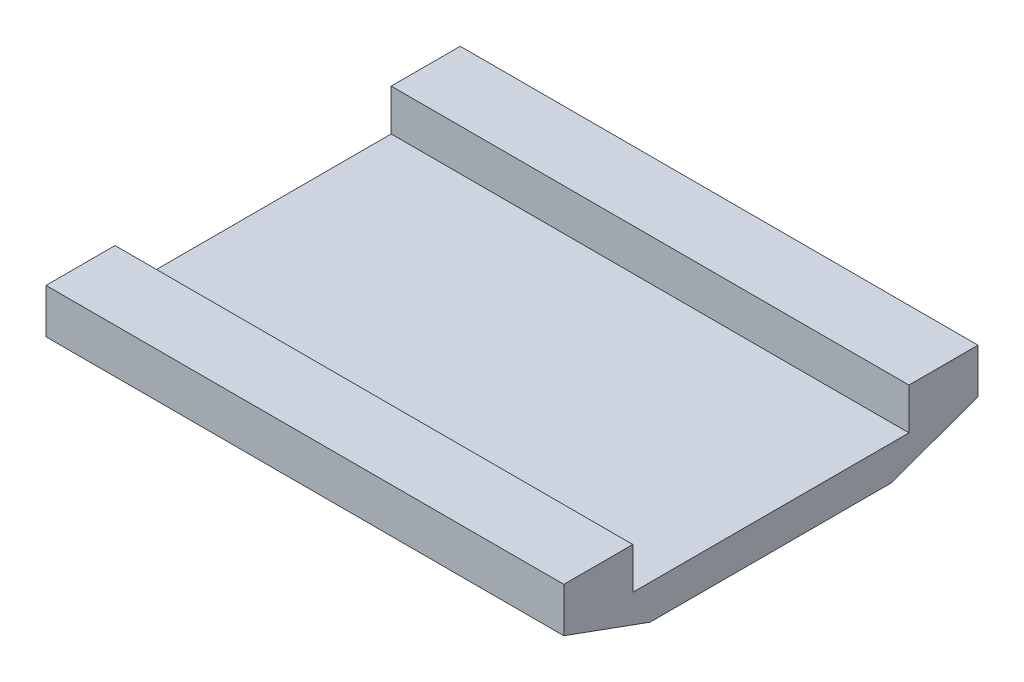
from build123d import *

# Parameters (mm, degrees)
SKETCH1_W           = 38.1
SKETCH1_H           = 20.32
BOSS_EXTRUDE1_DEPTH = 2.54
SKETCH2_W           = 38.1
SKETCH2_H           = 5.08
BOSS_EXTRUDE2_DEPTH = 5.588
CHAMFER1_SIZE       = 6.35
CHAMFER1_SIZE2      = 2.311210988


with BuildPart() as part:
    # Sketch1 → Boss-Extrude1 (new body)
    with BuildSketch(Plane(origin=(0, 0, 0), x_dir=(1, 0, 0), z_dir=(0, 1, 0))):
        with Locations((2.513541667, -5.051275362)):
            Rectangle(SKETCH1_W, SKETCH1_H)
    extrude(amount=BOSS_EXTRUDE1_DEPTH)

    # Sketch2 → Boss-Extrude2 (add)
    with BuildSketch(Plane(origin=(0, 0, 0), x_dir=(1, 0, 0), z_dir=(0, 1, 0))):
        with Locations((2.513541667, 7.648724638)):
            Rectangle(SKETCH2_W, SKETCH2_H)
        with Locations((2.513541667, -17.751275362)):
            Rectangle(SKETCH2_W, SKETCH2_H)
    extrude(amount=BOSS_EXTRUDE2_DEPTH)

    # Chamfer1
    chamfer1_edges = [part.edges().sort_by_distance(p)[0] for p in [
        (2.513541667, 0, -10.188724638),
        (2.513541667, 0, 20.291275362),
    ]]
    chamfer1_side = [part.faces().sort_by_distance(p)[0] for p in [
        (2.513541667, 0, 5.051275362),
    ]]
    chamfer(chamfer1_edges, length=CHAMFER1_SIZE, length2=CHAMFER1_SIZE2, reference=chamfer1_side[0])


solid = part.part
